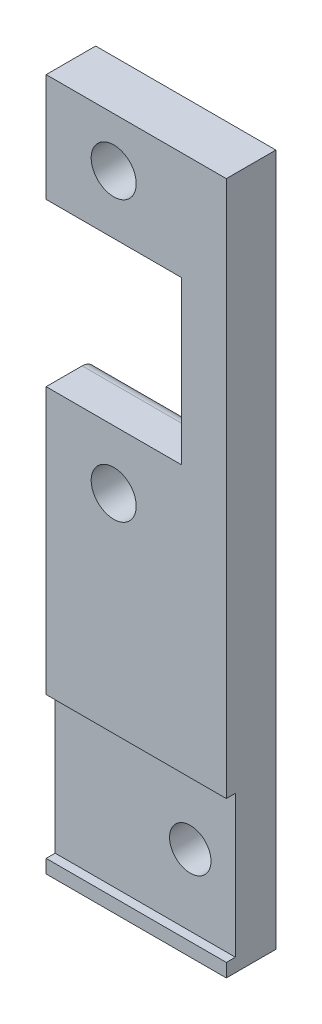
from build123d import *

# Parameters (mm, degrees)
PROFILESKETCH3_R               = 2.5
PROFILESKETCH3_R_2             = 2.3
PROFILEBOSS_EXTRUDE1_DEPTH     = 5.5
FILLET1_R                      = 1.5
SKETCH1_W                      = 20
SKETCH1_H                      = 15.75
SLIDINGMOUNTCUT_EXTRUDE1_DEPTH = 1


with BuildPart() as part:
    # ProfileSketch3 → ProfileBoss-Extrude1 (new body)
    with BuildSketch(Plane.XY):
        Polygon((0, 46.85), (15, 46.85), (15, 64.85), (0, 64.85), (0, 76.85), (20, 76.85), (20, 0), (0, 0), align=None)
        with Locations((7.5, 40.35)):
            Circle(PROFILESKETCH3_R, mode=Mode.SUBTRACT)
        with Locations((7.5, 71.35)):
            Circle(PROFILESKETCH3_R, mode=Mode.SUBTRACT)
        with Locations((15, 9.375)):
            Circle(PROFILESKETCH3_R_2, mode=Mode.SUBTRACT)
    extrude(amount=PROFILEBOSS_EXTRUDE1_DEPTH)

    # Fillet1
    fillet1_edges = [part.edges().sort_by_distance(p)[0] for p in [
        (7.5, 46.85, 0),
        (7.5, 64.85, 0),
    ]]
    fillet(fillet1_edges, radius=FILLET1_R)

    # Sketch1 → SlidingMountCut-Extrude1 (cut)
    with BuildSketch(Plane.XY.offset(5.5)):
        with Locations((10, 9.375)):
            Rectangle(SKETCH1_W, SKETCH1_H)
    extrude(amount=-SLIDINGMOUNTCUT_EXTRUDE1_DEPTH, mode=Mode.SUBTRACT)


solid = part.part
